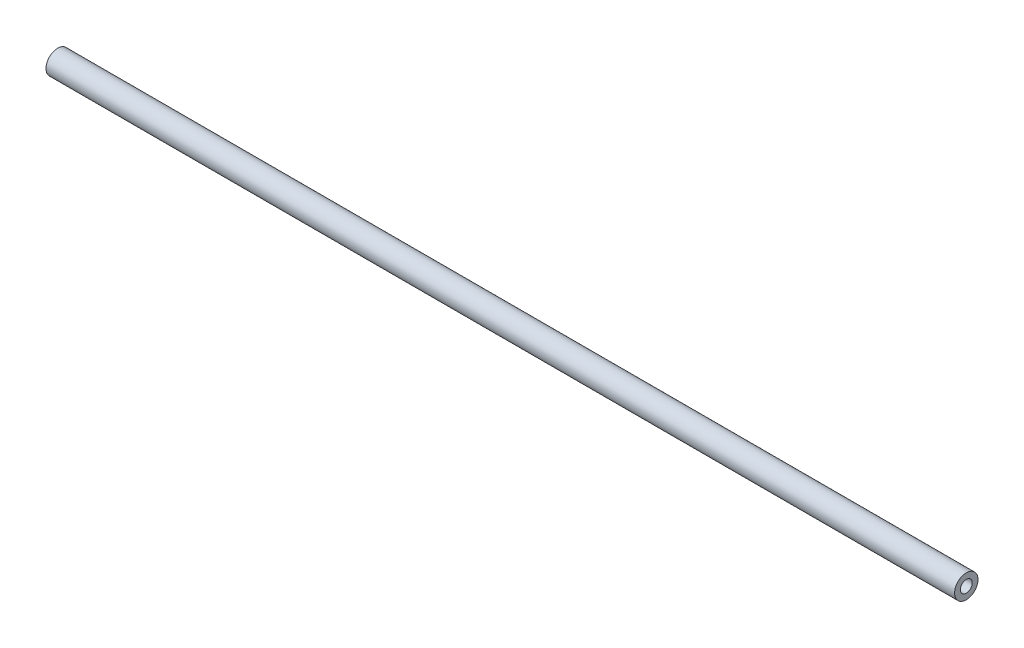
from build123d import *

# Parameters (mm, degrees)
SKETCH1_R           = 3.96875
BOSS_EXTRUDE1_DEPTH = 153.9875
SKETCH2_R           = 1.55575
CUT_EXTRUDE1_DEPTH  = 309.02613944


with BuildPart() as part:
    # Sketch1 → Boss-Extrude1 (new, symmetric)
    with BuildSketch(Plane(origin=(0, 0, 0), x_dir=(0, 0, -1), z_dir=(1, 0, 0))):
        Circle(SKETCH1_R)
    extrude(amount=BOSS_EXTRUDE1_DEPTH, both=True)

    # Sketch6 → #10-32 Tapped Hole1 (revolve, cut)
    with BuildSketch(Plane(origin=(-153.9875, 0, 0), x_dir=(0, 0, 1), z_dir=(0, 1, 0))):
        Polygon((0, 0), (0, 26.613317848), (2.0193, 25.4), (2.0193, 0), align=None)
    f_10_32_tapped_hole1 = revolve(axis=Axis((-160.3375, 0, 0), (1, 0, 0)), mode=Mode.SUBTRACT)

    # Sketch2 → Cut-Extrude1 (cut, through all)
    with BuildSketch(Plane(origin=(153.9875, 0, 0), x_dir=(0, 0, -1), z_dir=(1, 0, 0))):
        Circle(SKETCH2_R)
    extrude(amount=-CUT_EXTRUDE1_DEPTH, mode=Mode.SUBTRACT)

    # Mirror1: #10-32 Tapped Hole1 across plane
    add(f_10_32_tapped_hole1.mirror(Plane(origin=(0, 0, 0), x_dir=(0, 0, 1), z_dir=(1, 0, 0))), mode=Mode.SUBTRACT)


solid = part.part
